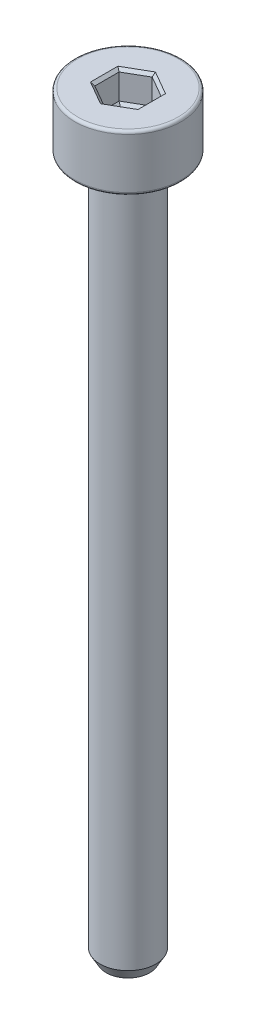
from build123d import *

# Parameters (mm, degrees)
SKETCH1_R           = 1
BOSS_EXTRUDE1_DEPTH = 25
SKETCH2_R           = 1.9
BOSS_EXTRUDE2_DEPTH = 2
CUT_EXTRUDE1_DEPTH  = 1
FILLET1_R           = 0.1
CHAMFER1_SIZE       = 0.1
CHAMFER2_SIZE       = 0.1
CUT_EXTRUDE2_DEPTH  = 0.1
CUT_EXTRUDE2_DRAFT  = -45


with BuildPart() as part:
    # Sketch1 → Boss-Extrude1 (new body)
    with BuildSketch(Plane(origin=(0, 0, 0), x_dir=(1, 0, 0), z_dir=(0, 1, 0))):
        with Locations(Location((0, 0, 0), (0, 0, 270))):
            Circle(SKETCH1_R)
    extrude(amount=BOSS_EXTRUDE1_DEPTH)

    # Sketch2 → Boss-Extrude2 (add)
    with BuildSketch(Plane(origin=(0, 25, 0), x_dir=(1, 0, 0), z_dir=(0, 1, 0))):
        with Locations(Location((0, 0, 0), (0, 0, 270))):
            Circle(SKETCH2_R)
    extrude(amount=BOSS_EXTRUDE2_DEPTH)

    # Sketch3 → Cut-Extrude1 (cut)
    with BuildSketch(Plane(origin=(0, 27, 0), x_dir=(1, 0, 0), z_dir=(0, 1, 0))):
        Polygon((0, 0.866025404), (-0.75, 0.433012702), (-0.75, -0.433012702), (0, -0.866025404), (0.75, -0.433012702), (0.75, 0.433012702), align=None)
    extrude(amount=-CUT_EXTRUDE1_DEPTH, mode=Mode.SUBTRACT)

    # Fillet1
    fillet1_edges = [part.edges().sort_by_distance(p)[0] for p in [
        (0, 25, -1.9),
        (0, 27, -1.9),
    ]]
    fillet(fillet1_edges, radius=FILLET1_R)

    # Chamfer1
    chamfer1_edges = [part.edges().sort_by_distance(p)[0] for p in [
        (0, 0, -1),
    ]]
    chamfer(chamfer1_edges, length=CHAMFER1_SIZE)

    # Sketch4 → Cut-Revolve1 (revolve, cut)
    with BuildSketch(Plane.XY, mode=Mode.PRIVATE) as cut_revolve1_sk:
        Polygon((1.01, 0), (1.01, 0.4), (0.779059892, 0), align=None)
    revolve(cut_revolve1_sk.sketch.rotate(Axis((0, 0, 0), (0, 1, 0)), 180), axis=Axis((0, 0, 0), (0, 1, 0)), mode=Mode.SUBTRACT)

    # Chamfer2
    chamfer2_edges = [part.edges().sort_by_distance(p)[0] for p in [
        (0.375, 27, -0.649519053),
        (-0.375, 27, -0.649519053),
        (-0.75, 27, 0),
        (-0.375, 27, 0.649519053),
        (0.375, 27, 0.649519053),
        (0.75, 27, 0),
    ]]
    chamfer(chamfer2_edges, length=CHAMFER2_SIZE)


with BuildPart() as cut_extrude2_tool:
    # Sketch6 → Cut-Extrude2 (with draft: the straight prism first)
    with BuildSketch(Plane(origin=(0, 26, 0), x_dir=(1, 0, 0), z_dir=(0, 1, 0))):
        Polygon((0, 0.866025404), (-0.75, 0.433012702), (-0.75, -0.433012702), (0, -0.866025404), (0.75, -0.433012702), (0.75, 0.433012702), align=None)
    extrude(amount=-CUT_EXTRUDE2_DEPTH)
    # Cut-Extrude2: the draft: its side faces are tilted about the plane it starts from
    cut_extrude2_sides = [cut_extrude2_tool.faces().sort_by_distance(p)[0] for p in [
        (-0.375, 25.95, -0.649519053),
        (-0.75, 25.95, 0),
        (-0.375, 25.95, 0.649519053),
        (0.375, 25.95, 0.649519053),
        (0.75, 25.95, 0),
        (0.375, 25.95, -0.649519053),
    ]]
    draft(cut_extrude2_sides, Plane(origin=(0, 26, 0), x_dir=(1, 0, 0), z_dir=(0, 1, 0)), CUT_EXTRUDE2_DRAFT)


with BuildPart() as part_1:
    add(part.part)

    # Cut-Extrude2: cut by cut_extrude2_tool
    add(cut_extrude2_tool.part, mode=Mode.SUBTRACT)


solid = part_1.part
